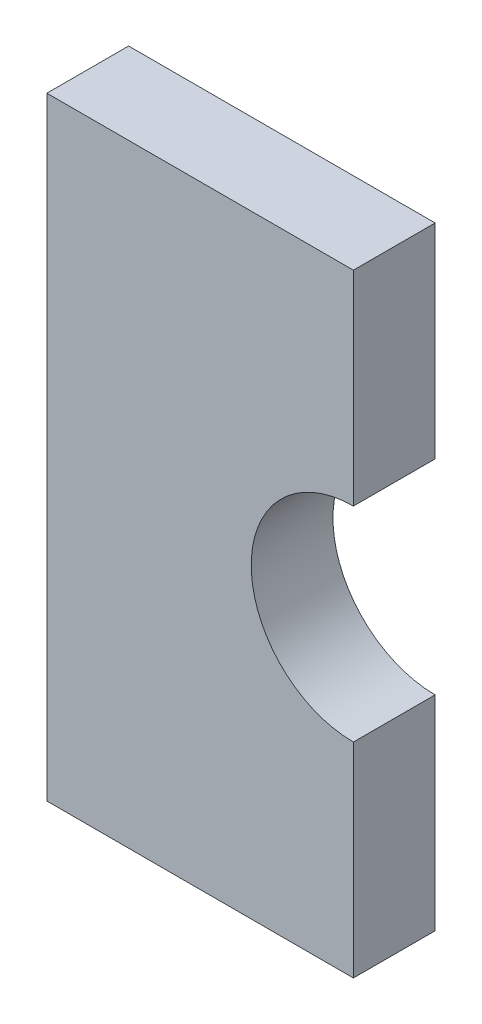
from build123d import *

# Parameters (mm, degrees)
BOSS_EXTRUDE1_DEPTH = 4


with BuildPart() as part:
    # Sketch1 → Boss-Extrude1 (new body)
    with BuildSketch(Plane.XY):
        with BuildLine():
            Line((0, 5), (0, 15))
            Line((0, 15), (-15, 15))
            Line((-15, 15), (-15, -15))
            Line((-15, -15), (0, -15))
            Line((0, -15), (0, -5))
            ThreePointArc((0, -5), (-5, 0), (0, 5))
        make_face()
    extrude(amount=BOSS_EXTRUDE1_DEPTH)


solid = part.part
